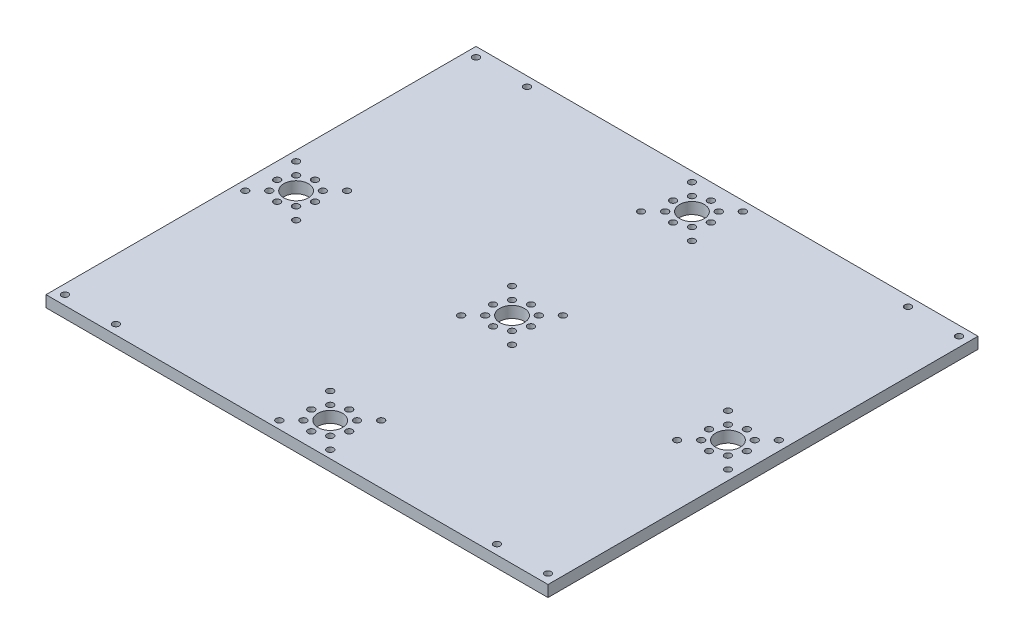
from build123d import *

# Parameters (mm, degrees)
ESQUISSE1_W        = 265
ESQUISSE1_H        = 227
ESQUISSE1_R        = 6.5
ESQUISSE1_R_2      = 1.75
ESQUISSE1_R_3      = 1.749999999
ESQUISSE1_W_2      = 191
ESQUISSE1_H_2      = 156.859849262
ESQUISSE1_W_3      = 17
ESQUISSE1_H_3      = 80
BOSS_EXTRU_1_DEPTH = 6
ESQUISSE2_W        = 17
ESQUISSE2_H        = 80
ESQUISSE2_W_2      = 191
ESQUISSE2_H_2      = 156.859849262
ESQUISSE2_R        = 6.5
ESQUISSE2_R_2      = 1.75
ESQUISSE2_R_3      = 1.749999999
BOSS_EXTRU_3_DEPTH = 6


with BuildPart() as part:
    # Esquisse1 → Boss.-Extru.1 (new body)
    with BuildSketch(Plane(origin=(0, 0, 0), x_dir=(1, 0, 0), z_dir=(0, 1, 0))):
        with Locations((132.5, -113.5)):
            Rectangle(ESQUISSE1_W, ESQUISSE1_H)
        with Locations(Location((246.5, -113.5, 0), (0, 0, 270))):
            Circle(ESQUISSE1_R, mode=Mode.SUBTRACT)
        with Locations(Location((246.5, -103.5, 0), (0, 0, 270))):
            Circle(ESQUISSE1_R_2, mode=Mode.SUBTRACT)
        with Locations(Location((253.571068024, -106.4289324, 0), (0, 0, 270))):
            Circle(ESQUISSE1_R_2, mode=Mode.SUBTRACT)
        with Locations(Location((256.5, -113.5, 0), (0, 0, 270))):
            Circle(ESQUISSE1_R_2, mode=Mode.SUBTRACT)
        with Locations(Location((253.571067812, -120.571067812, 0), (0, 0, 270))):
            Circle(ESQUISSE1_R_2, mode=Mode.SUBTRACT)
        with Locations(Location((246.5, -123.5, 0), (0, 0, 270))):
            Circle(ESQUISSE1_R_2, mode=Mode.SUBTRACT)
        with Locations(Location((239.428932188, -120.571067812, 0), (0, 0, 270))):
            Circle(ESQUISSE1_R_2, mode=Mode.SUBTRACT)
        with Locations(Location((236.5, -113.5, 0), (0, 0, 270))):
            Circle(ESQUISSE1_R_2, mode=Mode.SUBTRACT)
        with Locations(Location((239.42893238, -106.428931957, 0), (0, 0, 270))):
            Circle(ESQUISSE1_R_3, mode=Mode.SUBTRACT)
        with Locations(Location((259.935029054, -100.064971369, 0), (0, 0, 270))):
            Circle(ESQUISSE1_R_2, mode=Mode.SUBTRACT)
        with Locations(Location((259.935028843, -126.935028843, 0), (0, 0, 270))):
            Circle(ESQUISSE1_R_2, mode=Mode.SUBTRACT)
        with Locations(Location((233.064971369, -100.064970946, 0), (0, 0, 270))):
            Circle(ESQUISSE1_R_2, mode=Mode.SUBTRACT)
        with Locations(Location((233.064971157, -126.935028843, 0), (0, 0, 270))):
            Circle(ESQUISSE1_R_2, mode=Mode.SUBTRACT)
        with Locations(Location((132.5, -209.464962315, 0), (0, 0, 270))):
            Circle(ESQUISSE1_R, mode=Mode.SUBTRACT)
        with Locations(Location((132.5, -199.464962315, 0), (0, 0, 270))):
            Circle(ESQUISSE1_R_2, mode=Mode.SUBTRACT)
        with Locations(Location((139.571068024, -202.393894715, 0), (0, 0, 270))):
            Circle(ESQUISSE1_R_2, mode=Mode.SUBTRACT)
        with Locations(Location((142.5, -209.464962315, 0), (0, 0, 270))):
            Circle(ESQUISSE1_R_2, mode=Mode.SUBTRACT)
        with Locations(Location((139.571067812, -216.536030127, 0), (0, 0, 270))):
            Circle(ESQUISSE1_R_2, mode=Mode.SUBTRACT)
        with Locations(Location((132.5, -219.464962315, 0), (0, 0, 270))):
            Circle(ESQUISSE1_R_2, mode=Mode.SUBTRACT)
        with Locations(Location((125.428932188, -216.536030127, 0), (0, 0, 270))):
            Circle(ESQUISSE1_R_2, mode=Mode.SUBTRACT)
        with Locations(Location((122.5, -209.464962315, 0), (0, 0, 270))):
            Circle(ESQUISSE1_R_2, mode=Mode.SUBTRACT)
        with Locations(Location((125.42893238, -202.393894272, 0), (0, 0, 270))):
            Circle(ESQUISSE1_R_3, mode=Mode.SUBTRACT)
        with Locations(Location((145.935029054, -196.029933685, 0), (0, 0, 270))):
            Circle(ESQUISSE1_R_2, mode=Mode.SUBTRACT)
        with Locations(Location((145.935028843, -222.899991158, 0), (0, 0, 270))):
            Circle(ESQUISSE1_R_2, mode=Mode.SUBTRACT)
        with Locations(Location((119.064971369, -196.029933261, 0), (0, 0, 270))):
            Circle(ESQUISSE1_R_2, mode=Mode.SUBTRACT)
        with Locations(Location((119.064971157, -222.899991158, 0), (0, 0, 270))):
            Circle(ESQUISSE1_R_2, mode=Mode.SUBTRACT)
        with Locations(Location((18.513965978, -113.5, 0), (0, 0, 270))):
            Circle(ESQUISSE1_R, mode=Mode.SUBTRACT)
        with Locations(Location((18.513965978, -103.5, 0), (0, 0, 270))):
            Circle(ESQUISSE1_R_2, mode=Mode.SUBTRACT)
        with Locations(Location((25.585034002, -106.4289324, 0), (0, 0, 270))):
            Circle(ESQUISSE1_R_2, mode=Mode.SUBTRACT)
        with Locations(Location((28.513965978, -113.5, 0), (0, 0, 270))):
            Circle(ESQUISSE1_R_2, mode=Mode.SUBTRACT)
        with Locations(Location((25.58503379, -120.571067812, 0), (0, 0, 270))):
            Circle(ESQUISSE1_R_2, mode=Mode.SUBTRACT)
        with Locations(Location((18.513965978, -123.5, 0), (0, 0, 270))):
            Circle(ESQUISSE1_R_2, mode=Mode.SUBTRACT)
        with Locations(Location((11.442898166, -120.571067812, 0), (0, 0, 270))):
            Circle(ESQUISSE1_R_2, mode=Mode.SUBTRACT)
        with Locations(Location((8.513965978, -113.5, 0), (0, 0, 270))):
            Circle(ESQUISSE1_R_2, mode=Mode.SUBTRACT)
        with Locations(Location((11.442898358, -106.428931957, 0), (0, 0, 270))):
            Circle(ESQUISSE1_R_3, mode=Mode.SUBTRACT)
        with Locations(Location((31.948995033, -100.064971369, 0), (0, 0, 270))):
            Circle(ESQUISSE1_R_2, mode=Mode.SUBTRACT)
        with Locations(Location((31.948994821, -126.935028843, 0), (0, 0, 270))):
            Circle(ESQUISSE1_R_2, mode=Mode.SUBTRACT)
        with Locations(Location((5.078937347, -100.064970946, 0), (0, 0, 270))):
            Circle(ESQUISSE1_R_2, mode=Mode.SUBTRACT)
        with Locations(Location((5.078937136, -126.935028843, 0), (0, 0, 270))):
            Circle(ESQUISSE1_R_2, mode=Mode.SUBTRACT)
        with Locations(Location((132.5, -18.5, 0), (0, 0, 270))):
            Circle(ESQUISSE1_R, mode=Mode.SUBTRACT)
        with Locations(Location((132.5, -8.5, 0), (0, 0, 270))):
            Circle(ESQUISSE1_R_2, mode=Mode.SUBTRACT)
        with Locations(Location((139.571068024, -11.4289324, 0), (0, 0, 270))):
            Circle(ESQUISSE1_R_2, mode=Mode.SUBTRACT)
        with Locations(Location((142.5, -18.5, 0), (0, 0, 270))):
            Circle(ESQUISSE1_R_2, mode=Mode.SUBTRACT)
        with Locations(Location((139.571067812, -25.571067812, 0), (0, 0, 270))):
            Circle(ESQUISSE1_R_2, mode=Mode.SUBTRACT)
        with Locations(Location((132.5, -28.5, 0), (0, 0, 270))):
            Circle(ESQUISSE1_R_2, mode=Mode.SUBTRACT)
        with Locations(Location((125.428932188, -25.571067812, 0), (0, 0, 270))):
            Circle(ESQUISSE1_R_2, mode=Mode.SUBTRACT)
        with Locations(Location((122.5, -18.5, 0), (0, 0, 270))):
            Circle(ESQUISSE1_R_2, mode=Mode.SUBTRACT)
        with Locations(Location((125.42893238, -11.428931957, 0), (0, 0, 270))):
            Circle(ESQUISSE1_R_3, mode=Mode.SUBTRACT)
        with Locations(Location((145.935029054, -5.064971369, 0), (0, 0, 270))):
            Circle(ESQUISSE1_R_2, mode=Mode.SUBTRACT)
        with Locations(Location((145.935028843, -31.935028843, 0), (0, 0, 270))):
            Circle(ESQUISSE1_R_2, mode=Mode.SUBTRACT)
        with Locations(Location((119.064971369, -5.064970946, 0), (0, 0, 270))):
            Circle(ESQUISSE1_R_2, mode=Mode.SUBTRACT)
        with Locations(Location((119.064971157, -31.935028843, 0), (0, 0, 270))):
            Circle(ESQUISSE1_R_2, mode=Mode.SUBTRACT)
        with Locations(Location((260, -5, 0), (0, 0, 270))):
            Circle(ESQUISSE1_R_2, mode=Mode.SUBTRACT)
        with Locations(Location((233.064971369, -5, 0), (0, 0, 270))):
            Circle(ESQUISSE1_R_2, mode=Mode.SUBTRACT)
        with Locations(Location((260, -222, 0), (0, 0, 90))):
            Circle(ESQUISSE1_R_2, mode=Mode.SUBTRACT)
        with Locations(Location((233.064971369, -222, 0), (0, 0, 90))):
            Circle(ESQUISSE1_R_2, mode=Mode.SUBTRACT)
        with Locations(Location((5, -5, 0), (0, 0, 90))):
            Circle(ESQUISSE1_R_2, mode=Mode.SUBTRACT)
        with Locations(Location((31.935028631, -5, 0), (0, 0, 90))):
            Circle(ESQUISSE1_R_2, mode=Mode.SUBTRACT)
        with Locations(Location((5, -222, 0), (0, 0, 270))):
            Circle(ESQUISSE1_R_2, mode=Mode.SUBTRACT)
        with Locations(Location((31.935028631, -222, 0), (0, 0, 270))):
            Circle(ESQUISSE1_R_2, mode=Mode.SUBTRACT)
        with Locations((132.5, -113.5)):
            Rectangle(ESQUISSE1_W_2, ESQUISSE1_H_2, mode=Mode.SUBTRACT)
        with Locations((246.5, -58)):
            Rectangle(ESQUISSE1_W_3, ESQUISSE1_H_3, mode=Mode.SUBTRACT)
        with Locations((246.5, -169)):
            Rectangle(ESQUISSE1_W_3, ESQUISSE1_H_3, mode=Mode.SUBTRACT)
        with Locations((18.5, -58)):
            Rectangle(ESQUISSE1_W_3, ESQUISSE1_H_3, mode=Mode.SUBTRACT)
        with Locations((18.5, -169)):
            Rectangle(ESQUISSE1_W_3, ESQUISSE1_H_3, mode=Mode.SUBTRACT)
    extrude(amount=BOSS_EXTRU_1_DEPTH)

    # Esquisse2 → Boss.-Extru.3 (add)
    # profile 1 of 5: a face of its own
    with BuildSketch(Plane(origin=(0, 6, 0), x_dir=(1, 0, 0), z_dir=(0, 1, 0))):
        with Locations((18.5, -58)):
            Rectangle(ESQUISSE2_W, ESQUISSE2_H)
    # profile 2 of 5: a face of its own
    with BuildSketch(Plane(origin=(0, 6, 0), x_dir=(1, 0, 0), z_dir=(0, 1, 0))):
        with Locations((132.5, -113.5)):
            Rectangle(ESQUISSE2_W_2, ESQUISSE2_H_2)
        with Locations(Location((132.5, -113.5, 0), (0, 0, 270))):
            Circle(ESQUISSE2_R, mode=Mode.SUBTRACT)
        with Locations(Location((132.5, -103.5, 0), (0, 0, 270))):
            Circle(ESQUISSE2_R_2, mode=Mode.SUBTRACT)
        with Locations(Location((139.571068024, -106.4289324, 0), (0, 0, 270))):
            Circle(ESQUISSE2_R_2, mode=Mode.SUBTRACT)
        with Locations(Location((142.5, -113.5, 0), (0, 0, 270))):
            Circle(ESQUISSE2_R_2, mode=Mode.SUBTRACT)
        with Locations(Location((139.571067812, -120.571067812, 0), (0, 0, 270))):
            Circle(ESQUISSE2_R_2, mode=Mode.SUBTRACT)
        with Locations(Location((132.5, -123.5, 0), (0, 0, 270))):
            Circle(ESQUISSE2_R_2, mode=Mode.SUBTRACT)
        with Locations(Location((125.428932188, -120.571067812, 0), (0, 0, 270))):
            Circle(ESQUISSE2_R_2, mode=Mode.SUBTRACT)
        with Locations(Location((122.5, -113.5, 0), (0, 0, 270))):
            Circle(ESQUISSE2_R_2, mode=Mode.SUBTRACT)
        with Locations(Location((125.42893238, -106.428931957, 0), (0, 0, 270))):
            Circle(ESQUISSE2_R_3, mode=Mode.SUBTRACT)
        with Locations(Location((145.935029054, -100.064971369, 0), (0, 0, 270))):
            Circle(ESQUISSE2_R_2, mode=Mode.SUBTRACT)
        with Locations(Location((145.935028843, -126.935028843, 0), (0, 0, 270))):
            Circle(ESQUISSE2_R_2, mode=Mode.SUBTRACT)
        with Locations(Location((119.064971369, -100.064970946, 0), (0, 0, 270))):
            Circle(ESQUISSE2_R_2, mode=Mode.SUBTRACT)
        with Locations(Location((119.064971157, -126.935028843, 0), (0, 0, 270))):
            Circle(ESQUISSE2_R_2, mode=Mode.SUBTRACT)
    # profile 3 of 5: a face of its own
    with BuildSketch(Plane(origin=(0, 6, 0), x_dir=(1, 0, 0), z_dir=(0, 1, 0))):
        with Locations((246.5, -58)):
            Rectangle(ESQUISSE2_W, ESQUISSE2_H)
    # profile 4 of 5: a face of its own
    with BuildSketch(Plane(origin=(0, 6, 0), x_dir=(1, 0, 0), z_dir=(0, 1, 0))):
        with Locations((246.5, -169)):
            Rectangle(ESQUISSE2_W, ESQUISSE2_H)
    # profile 5 of 5: a face of its own
    with BuildSketch(Plane(origin=(0, 6, 0), x_dir=(1, 0, 0), z_dir=(0, 1, 0))):
        with Locations((18.5, -169)):
            Rectangle(ESQUISSE2_W, ESQUISSE2_H)
    extrude(amount=-BOSS_EXTRU_3_DEPTH)


solid = part.part
